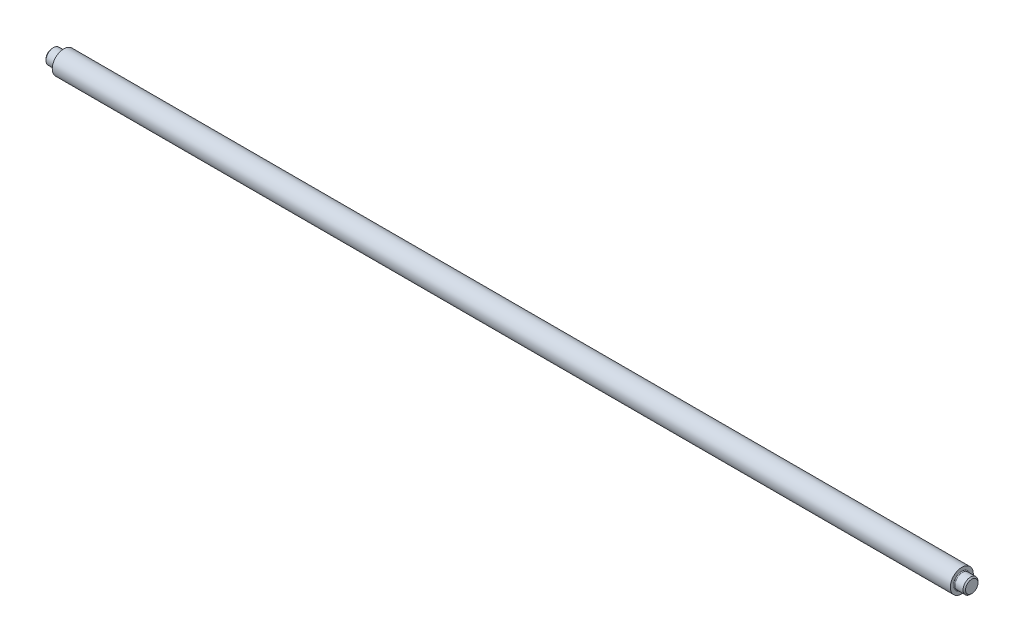
from build123d import *

# Parameters (mm, degrees)
SKETCH1_W = 360
SKETCH1_H = 4.615384615


with BuildPart() as part:
    # Sketch1 → Revolve1 (revolve)
    with BuildSketch(Plane.XY, mode=Mode.PRIVATE) as revolve1_sk:
        with Locations((184.615384615, 2.307692307)):
            Rectangle(SKETCH1_W, SKETCH1_H)
    revolve(revolve1_sk.sketch.rotate(Axis((364.615384615, 0, 0), (-1, 0, 0)), 270), axis=Axis((364.615384615, 0, 0), (-1, 0, 0)))

    # Sketch3 → Revolve3 (revolve)
    with BuildSketch(Plane.XY, mode=Mode.PRIVATE) as revolve3_sk:
        with BuildLine():
            Line((364.615384615, 0), (364.615384615, 3.3))
            ThreePointArc((364.615384615, 3.3), (364.703252581, 3.087867966), (364.915384615, 3))
            Line((364.915384615, 3), (368.115384615, 3))
            Line((368.115384615, 3), (368.615384615, 2.5))
            Line((368.615384615, 2.5), (368.615384615, 0))
            Line((368.615384615, 0), (364.615384615, 0))
        make_face()
    revolve(revolve3_sk.sketch.rotate(Axis((368.615384615, 0, 0), (-1, 0, 0)), 270), axis=Axis((368.615384615, 0, 0), (-1, 0, 0)))


with BuildPart() as body_2:
    # Sketch2 → Revolve2 (revolve)
    with BuildSketch(Plane.XY, mode=Mode.PRIVATE) as revolve2_sk:
        with BuildLine():
            Line((0, 0), (0, 2.5))
            Line((0, 2.5), (0.5, 3))
            Line((0.5, 3), (3.7, 3))
            ThreePointArc((3.7, 3), (3.912132034, 3.087867966), (4, 3.3))
            Line((4, 3.3), (4, 0))
            Line((4, 0), (0, 0))
        make_face()
    revolve(revolve2_sk.sketch.rotate(Axis((4, 0, 0), (-1, 0, 0)), 270), axis=Axis((4, 0, 0), (-1, 0, 0)))


solid = Compound([part.part, body_2.part])
